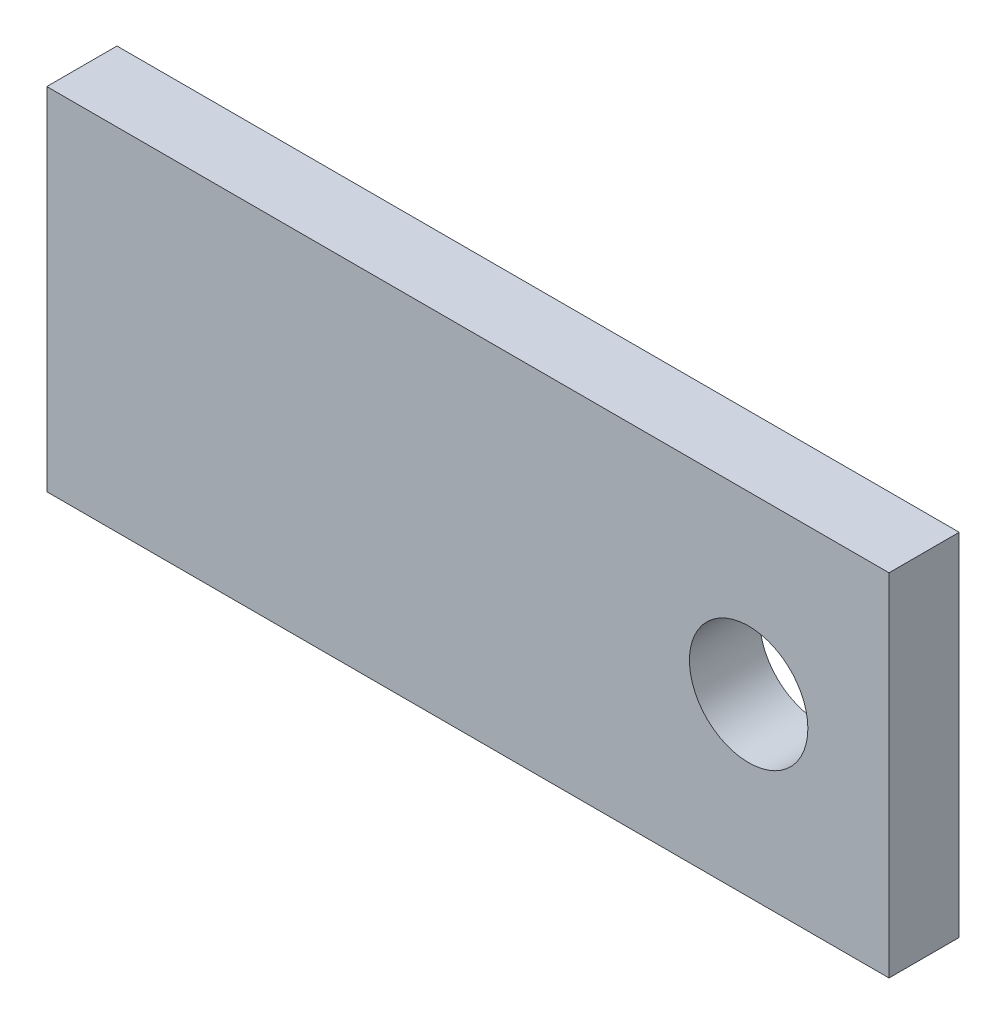
from build123d import *

# Parameters (mm, degrees)
SKETCH1_W                        = 76.2
SKETCH1_H                        = 31.75
EXTRUDE1_DEPTH                   = 3.175
F_27_64_0_42188_DIAMETER_HOLE1_D = 10.715752


with BuildPart() as part:
    # Sketch1 → Extrude1 (new, symmetric)
    with BuildSketch(Plane.XY):
        Rectangle(SKETCH1_W, SKETCH1_H)
    extrude(amount=EXTRUDE1_DEPTH, both=True)

    # 27/64 (0.42188) Diameter Hole1 (through all)
    with Locations(Plane(origin=(25.4, 0, 3.175), x_dir=(1, 0, 0), z_dir=(0, 0, 1))):
        with Locations((0, 0)):
            Hole(F_27_64_0_42188_DIAMETER_HOLE1_D / 2)


solid = part.part
